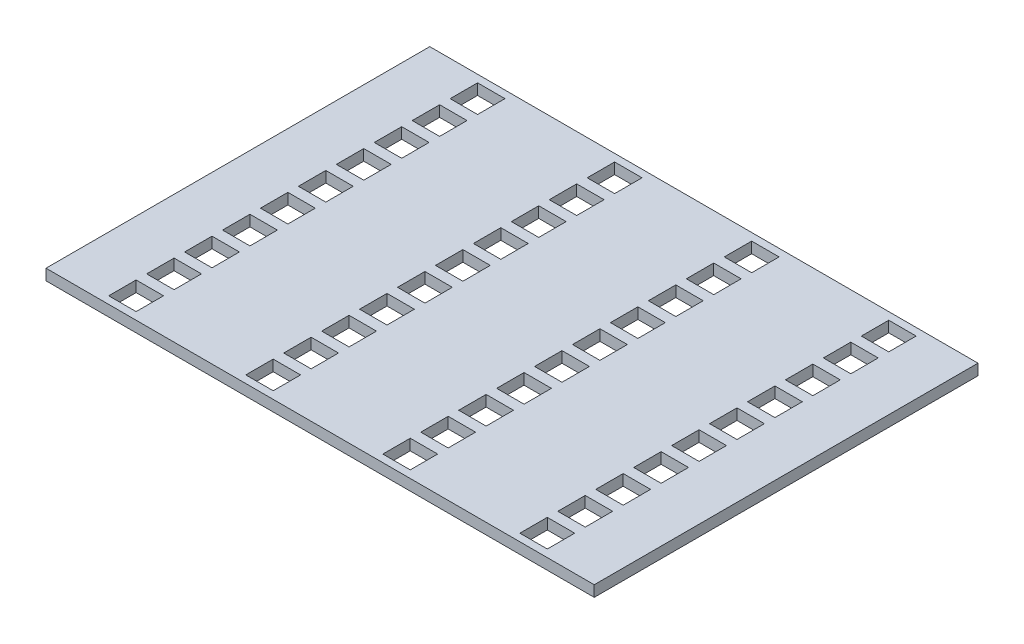
from build123d import *

# Parameters (mm, degrees)
SKETCH1_W           = 100
SKETCH1_H           = 70
BOSS_EXTRUDE1_DEPTH = 2
SKETCH2_W           = 5
SKETCH2_H           = 5
CUT_EXTRUDE1_DEPTH  = 10


with BuildPart() as part:
    # Sketch1 → Boss-Extrude1 (new body)
    with BuildSketch(Plane(origin=(0, 0, 0), x_dir=(1, 0, 0), z_dir=(0, 1, 0))):
        with Locations((-22.5, 23.020833333)):
            Rectangle(SKETCH1_W, SKETCH1_H)
    extrude(amount=BOSS_EXTRUDE1_DEPTH)

    # Sketch2 → Cut-Extrude1 (cut)
    with BuildSketch(Plane(origin=(0, 2, 0), x_dir=(1, 0, 0), z_dir=(0, 1, 0))):
        with Locations((-34.922189654, 54.160833333)):
            Rectangle(SKETCH2_W, SKETCH2_H)
        with Locations((-59.922189654, 54.160833333)):
            Rectangle(SKETCH2_W, SKETCH2_H)
        with Locations((-9.922189654, 54.160833333)):
            Rectangle(SKETCH2_W, SKETCH2_H)
        with Locations((15.077810346, 54.160833333)):
            Rectangle(SKETCH2_W, SKETCH2_H)
        with Locations((-34.922189654, 47.240833333)):
            Rectangle(SKETCH2_W, SKETCH2_H)
        with Locations((-9.922189654, 47.240833333)):
            Rectangle(SKETCH2_W, SKETCH2_H)
        with Locations((15.077810346, 47.240833333)):
            Rectangle(SKETCH2_W, SKETCH2_H)
        with Locations((-34.922189654, 40.320833333)):
            Rectangle(SKETCH2_W, SKETCH2_H)
        with Locations((-9.922189654, 40.320833333)):
            Rectangle(SKETCH2_W, SKETCH2_H)
        with Locations((15.077810346, 40.320833333)):
            Rectangle(SKETCH2_W, SKETCH2_H)
        with Locations((-34.922189654, 33.400833333)):
            Rectangle(SKETCH2_W, SKETCH2_H)
        with Locations((-9.922189654, 33.400833333)):
            Rectangle(SKETCH2_W, SKETCH2_H)
        with Locations((15.077810346, 33.400833333)):
            Rectangle(SKETCH2_W, SKETCH2_H)
        with Locations((-34.922189654, 26.480833333)):
            Rectangle(SKETCH2_W, SKETCH2_H)
        with Locations((-9.922189654, 26.480833333)):
            Rectangle(SKETCH2_W, SKETCH2_H)
        with Locations((15.077810346, 26.480833333)):
            Rectangle(SKETCH2_W, SKETCH2_H)
        with Locations((-34.922189654, 19.560833333)):
            Rectangle(SKETCH2_W, SKETCH2_H)
        with Locations((-9.922189654, 19.560833333)):
            Rectangle(SKETCH2_W, SKETCH2_H)
        with Locations((15.077810346, 19.560833333)):
            Rectangle(SKETCH2_W, SKETCH2_H)
        with Locations((-34.922189654, 12.640833333)):
            Rectangle(SKETCH2_W, SKETCH2_H)
        with Locations((-9.922189654, 12.640833333)):
            Rectangle(SKETCH2_W, SKETCH2_H)
        with Locations((15.077810346, 12.640833333)):
            Rectangle(SKETCH2_W, SKETCH2_H)
        with Locations((-34.922189654, 5.720833333)):
            Rectangle(SKETCH2_W, SKETCH2_H)
        with Locations((-9.922189654, 5.720833333)):
            Rectangle(SKETCH2_W, SKETCH2_H)
        with Locations((15.077810346, 5.720833333)):
            Rectangle(SKETCH2_W, SKETCH2_H)
        with Locations((-34.922189654, -1.199166667)):
            Rectangle(SKETCH2_W, SKETCH2_H)
        with Locations((-9.922189654, -1.199166667)):
            Rectangle(SKETCH2_W, SKETCH2_H)
        with Locations((15.077810346, -1.199166667)):
            Rectangle(SKETCH2_W, SKETCH2_H)
        with Locations((-34.922189654, -8.119166667)):
            Rectangle(SKETCH2_W, SKETCH2_H)
        with Locations((-9.922189654, -8.119166667)):
            Rectangle(SKETCH2_W, SKETCH2_H)
        with Locations((15.077810346, -8.119166667)):
            Rectangle(SKETCH2_W, SKETCH2_H)
        with Locations((-59.922189654, 47.240833333)):
            Rectangle(SKETCH2_W, SKETCH2_H)
        with Locations((-59.922189654, 40.320833333)):
            Rectangle(SKETCH2_W, SKETCH2_H)
        with Locations((-59.922189654, 33.400833333)):
            Rectangle(SKETCH2_W, SKETCH2_H)
        with Locations((-59.922189654, 26.480833333)):
            Rectangle(SKETCH2_W, SKETCH2_H)
        with Locations((-59.922189654, 19.560833333)):
            Rectangle(SKETCH2_W, SKETCH2_H)
        with Locations((-59.922189654, 12.640833333)):
            Rectangle(SKETCH2_W, SKETCH2_H)
        with Locations((-59.922189654, 5.720833333)):
            Rectangle(SKETCH2_W, SKETCH2_H)
        with Locations((-59.922189654, -1.199166667)):
            Rectangle(SKETCH2_W, SKETCH2_H)
        with Locations((-59.922189654, -8.119166667)):
            Rectangle(SKETCH2_W, SKETCH2_H)
    extrude(amount=-CUT_EXTRUDE1_DEPTH, mode=Mode.SUBTRACT)


solid = part.part
